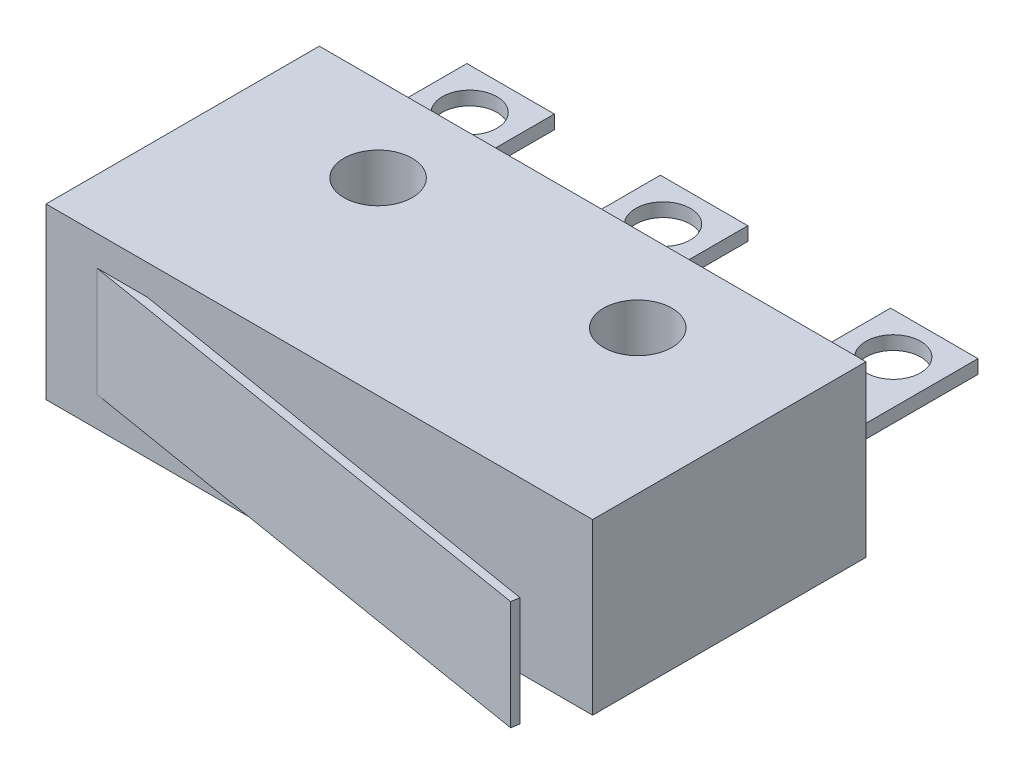
from build123d import *

# Parameters (mm, degrees)
SKETCH1_W           = 20
SKETCH1_H           = 10
BOSS_EXTRUDE1_DEPTH = 3.1
BOSS_EXTRUDE3_DEPTH = 2
SKETCH4_W           = 3.2
SKETCH4_H           = 0.5
BOSS_EXTRUDE4_DEPTH = 5
SKETCH7_R           = 1
CUT_EXTRUDE1_DEPTH  = 5
SKETCH8_R           = 1.25
CUT_EXTRUDE2_DEPTH  = 16.473248494


with BuildPart() as part:
    # Sketch1 → Boss-Extrude1 (new, symmetric)
    with BuildSketch(Plane(origin=(0, 0, 0), x_dir=(1, 0, 0), z_dir=(0, 1, 0))):
        Rectangle(SKETCH1_W, SKETCH1_H)
    extrude(amount=BOSS_EXTRUDE1_DEPTH, both=True)

    # Sketch3 → Boss-Extrude3 (add, symmetric)
    with BuildSketch(Plane(origin=(0, 0, 0), x_dir=(1, 0, 0), z_dir=(0, 1, 0))):
        Polygon((-8.139274181, -5), (10, -8), (10.048951137, -7.704020632), (-6.300706076, -5), align=None)
    extrude(amount=BOSS_EXTRUDE3_DEPTH, both=True)

    # Sketch4 → Boss-Extrude4 (add)
    with BuildSketch(Plane(origin=(0, 0, -5), x_dir=(-1, 0, 0), z_dir=(0, 0, -1))):
        with Locations((-7.5, 0)):
            Rectangle(SKETCH4_W, SKETCH4_H)
        with Locations((0.921991111, 0)):
            Rectangle(SKETCH4_W, SKETCH4_H)
        with Locations((8, 0)):
            Rectangle(SKETCH4_W, SKETCH4_H)
    extrude(amount=BOSS_EXTRUDE4_DEPTH)

    # Sketch7 → Cut-Extrude1 (cut)
    with BuildSketch(Plane(origin=(0, 0.25, 0), x_dir=(1, 0, 0), z_dir=(0, 1, 0))):
        with Locations(Location((-8, 8.5, 0), (0, 0, 270))):
            Circle(SKETCH7_R)
        with Locations(Location((-0.921991111, 8.5, 0), (0, 0, 270))):
            Circle(SKETCH7_R)
        with Locations(Location((7.5, 8.5, 0), (0, 0, 270))):
            Circle(SKETCH7_R)
    extrude(amount=-CUT_EXTRUDE1_DEPTH, mode=Mode.SUBTRACT)

    # Sketch8 → Cut-Extrude2 (cut, through all)
    with BuildSketch(Plane(origin=(0, 3.1, 0), x_dir=(1, 0, 0), z_dir=(0, 1, 0))):
        with Locations(Location((-4.75, 1.9, 0), (0, 0, 270))):
            Circle(SKETCH8_R)
        with Locations(Location((4.75, 1.9, 0), (0, 0, 270))):
            Circle(SKETCH8_R)
    extrude(amount=-CUT_EXTRUDE2_DEPTH, mode=Mode.SUBTRACT)


solid = part.part
